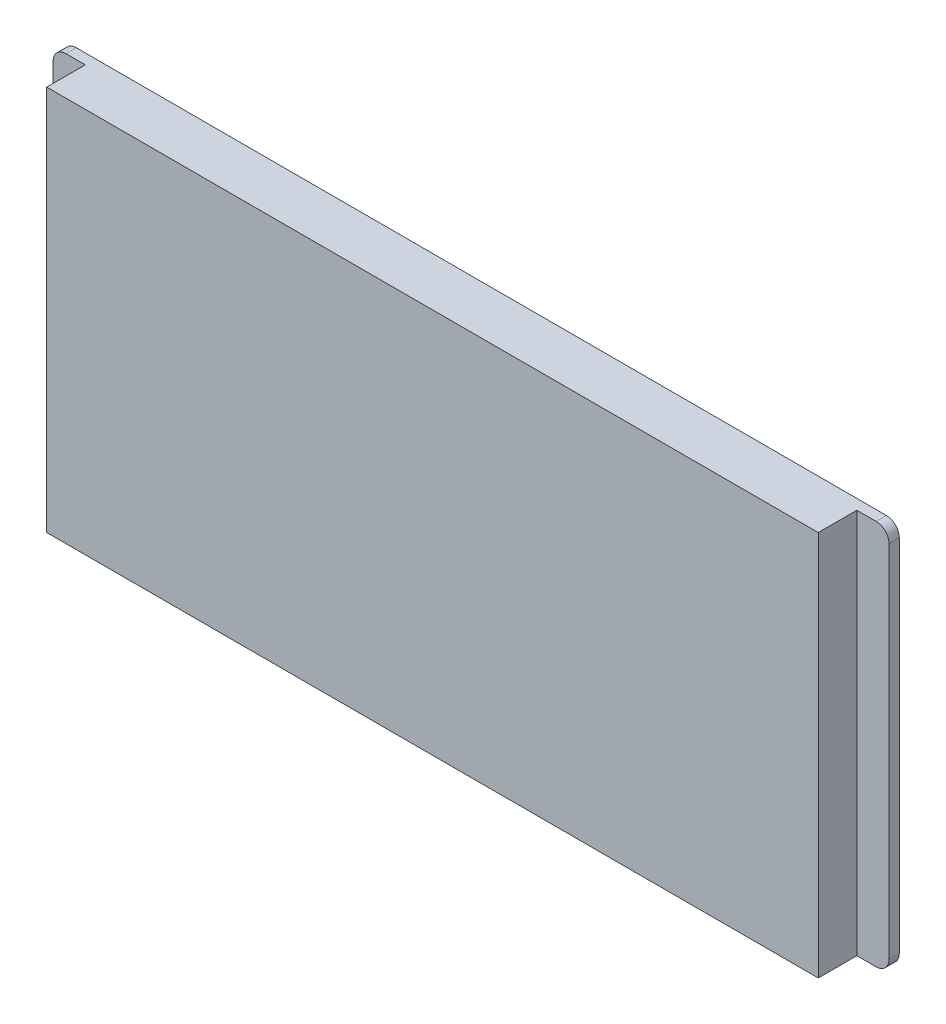
from build123d import *

# Parameters (mm, degrees)
SKETCH_1_W      = 120
SKETCH_1_H      = 60
EXTRUDE_1_DEPTH = 7.6
SKETCH_5_W      = 130
SKETCH_5_H      = 60
EXTRUDE_2_DEPTH = 1.6
FILLET_1_R      = 2


with BuildPart() as part:
    # 草图1 → 凸台-拉伸1 (new body)
    with BuildSketch(Plane.XY):
        Rectangle(SKETCH_1_W, SKETCH_1_H)
    extrude(amount=EXTRUDE_1_DEPTH)

    # 草图5 → 凸台-拉伸2 (add)
    with BuildSketch(Plane(origin=(0, 0, 0), x_dir=(-1, 0, 0), z_dir=(0, 0, -1))):
        Rectangle(SKETCH_5_W, SKETCH_5_H)
    extrude(amount=-EXTRUDE_2_DEPTH)

    # 圆角1
    fillet_1_edges = [part.edges().sort_by_distance(p)[0] for p in [
        (65, 30, 0.8),
        (-65, -30, 0.8),
        (65, -30, 0.8),
        (-65, 30, 0.8),
    ]]
    fillet(fillet_1_edges, radius=FILLET_1_R)


solid = part.part
